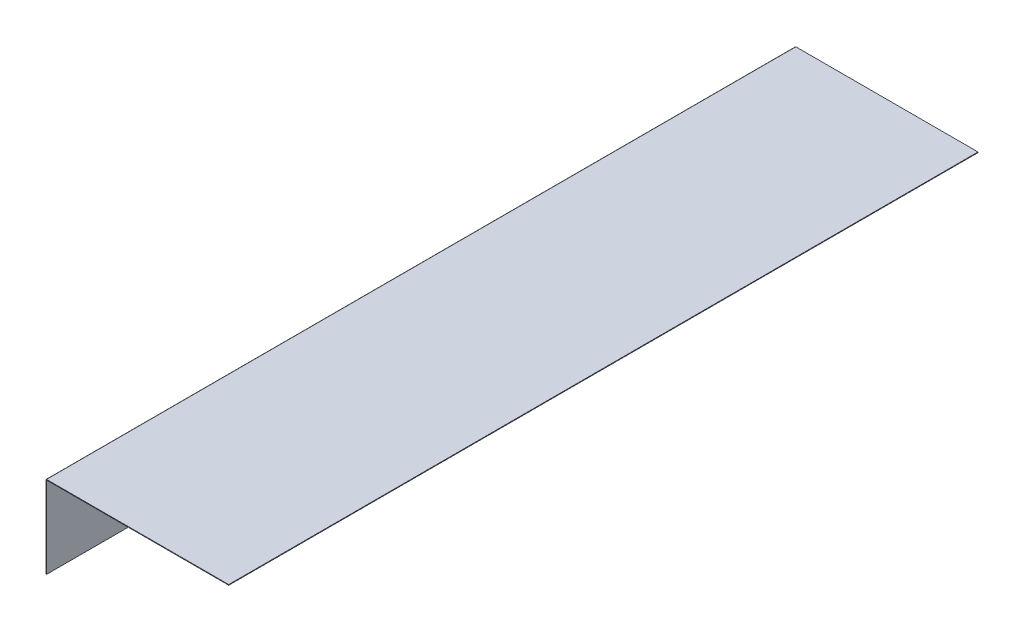
from build123d import *

# Parameters (mm, degrees)
BOSS_EXTRUDE1_DEPTH = 1230
FILLET1_R           = 1


with BuildPart() as part:
    # Sketch1 → Boss-Extrude1 (new body)
    with BuildSketch(Plane.XY):
        Polygon((0, 0), (0, 135), (300, 135), (300, 134), (1, 134), (1, 0), align=None)
    extrude(amount=BOSS_EXTRUDE1_DEPTH)

    # Fillet1
    fillet1_edges = [part.edges().sort_by_distance(p)[0] for p in [
        (0, 135, 615),
        (1, 134, 615),
    ]]
    fillet(fillet1_edges, radius=FILLET1_R)


solid = part.part
